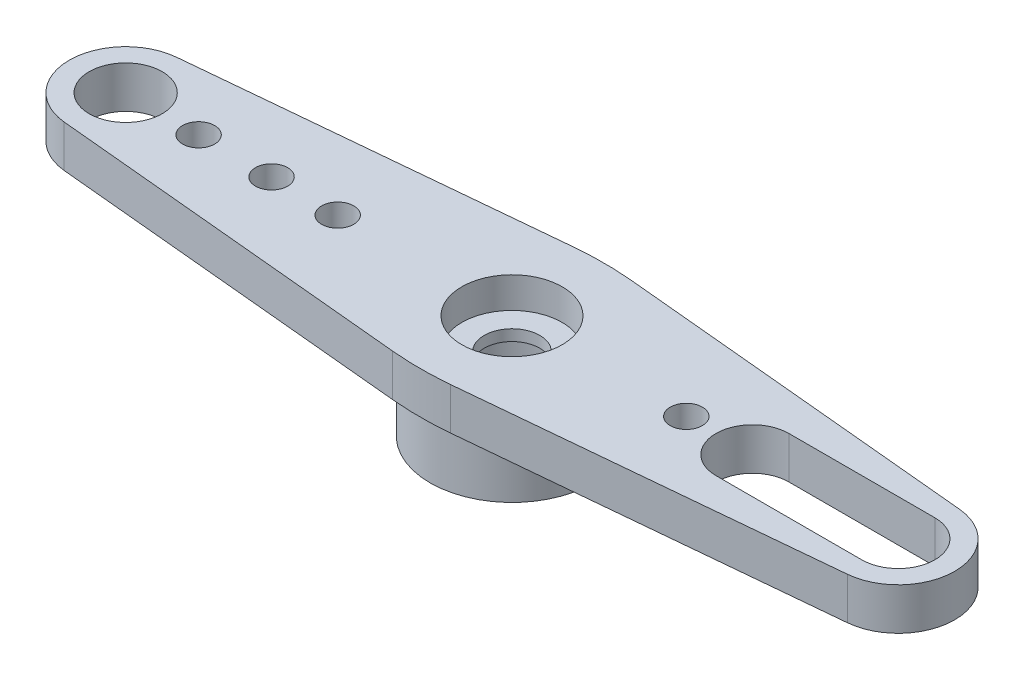
from build123d import *

# Parameters (mm, degrees)
SKETCH1_R           = 3.3655
SKETCH1_R_2         = 2.5
BOSS_EXTRUDE1_DEPTH = 2.54
SKETCH2_R           = 1.143
SKETCH2_R_2         = 0.6604
SKETCH2_R_3         = 1.5
BOSS_EXTRUDE2_DEPTH = 1.7272
FILLET1_R           = 12.7
CUT_EXTRUDE1_START  = -1.27
SKETCH3_R           = 2.06375
SKETCH3_R_2         = 1.143
CUT_EXTRUDE1_DEPTH  = 1.27


with BuildPart() as part:
    # Sketch1 → Boss-Extrude1 (new body)
    with BuildSketch(Plane(origin=(0, 0, 0), x_dir=(1, 0, 0), z_dir=(0, 1, 0))):
        with Locations(Location((0, 0, 0), (0, 0, 270))):
            Circle(SKETCH1_R)
        with Locations(Location((0, 0, 0), (0, 0, 270))):
            Circle(SKETCH1_R_2, mode=Mode.SUBTRACT)
    extrude(amount=BOSS_EXTRUDE1_DEPTH)

    # Sketch2 → Boss-Extrude2 (add)
    with BuildSketch(Plane(origin=(0, 2.54, 0), x_dir=(1, 0, 0), z_dir=(0, 1, 0))):
        with BuildLine():
            Line((0, 3.8227), (-16.092265178, 2.307544345))
            ThreePointArc((-16.092265178, 2.307544345), (-18.19275, 0), (-16.092265178, -2.307544345))
            Line((-16.092265178, -2.307544345), (0, -3.8227))
            Line((0, -3.8227), (16.092265178, -2.307544345))
            ThreePointArc((16.092265178, -2.307544345), (18.19275, 0), (16.092265178, 2.307544345))
            Line((16.092265178, 2.307544345), (0, 3.8227))
        make_face()
        with BuildLine():
            ThreePointArc((9.8806, -1.5), (8.3806, 0), (9.8806, 1.5))
            Line((9.8806, 1.5), (15.875, 1.5))
            ThreePointArc((15.875, 1.5), (17.375, 0), (15.875, -1.5))
            Line((15.875, -1.5), (9.8806, -1.5))
        make_face(mode=Mode.SUBTRACT)
        with Locations(Location((0, 0, 0), (0, 0, 270))):
            Circle(SKETCH2_R, mode=Mode.SUBTRACT)
        with Locations(Location((7.1628, 0, 0), (0, 0, 270))):
            Circle(SKETCH2_R_2, mode=Mode.SUBTRACT)
        with Locations(Location((-7.1628, 0, 0), (0, 0, 270))):
            Circle(SKETCH2_R_2, mode=Mode.SUBTRACT)
        with Locations(Location((-12.8778, 0, 0), (0, 0, 270))):
            Circle(SKETCH2_R_2, mode=Mode.SUBTRACT)
        with Locations(Location((-9.8806, 0, 0), (0, 0, 270))):
            Circle(SKETCH2_R_2, mode=Mode.SUBTRACT)
        with Locations(Location((-15.875, 0, 0), (0, 0, 270))):
            Circle(SKETCH2_R_3, mode=Mode.SUBTRACT)
    extrude(amount=BOSS_EXTRUDE2_DEPTH)

    # Fillet1
    fillet1_edges = [part.edges().sort_by_distance(p)[0] for p in [
        (0, 3.4036, 3.8227),
        (0, 3.4036, -3.8227),
    ]]
    fillet(fillet1_edges, radius=FILLET1_R)

    # Sketch3 → Cut-Extrude1 (cut)
    with BuildSketch(Plane(origin=(0, 4.2672, 0), x_dir=(1, 0, 0), z_dir=(0, 1, 0)).offset(CUT_EXTRUDE1_START)):
        with Locations(Location((0, 0, 0), (0, 0, 270))):
            Circle(SKETCH3_R)
        with Locations(Location((0, 0, 0), (0, 0, 270))):
            Circle(SKETCH3_R_2, mode=Mode.SUBTRACT)
    extrude(amount=CUT_EXTRUDE1_DEPTH, mode=Mode.SUBTRACT)


solid = part.part
